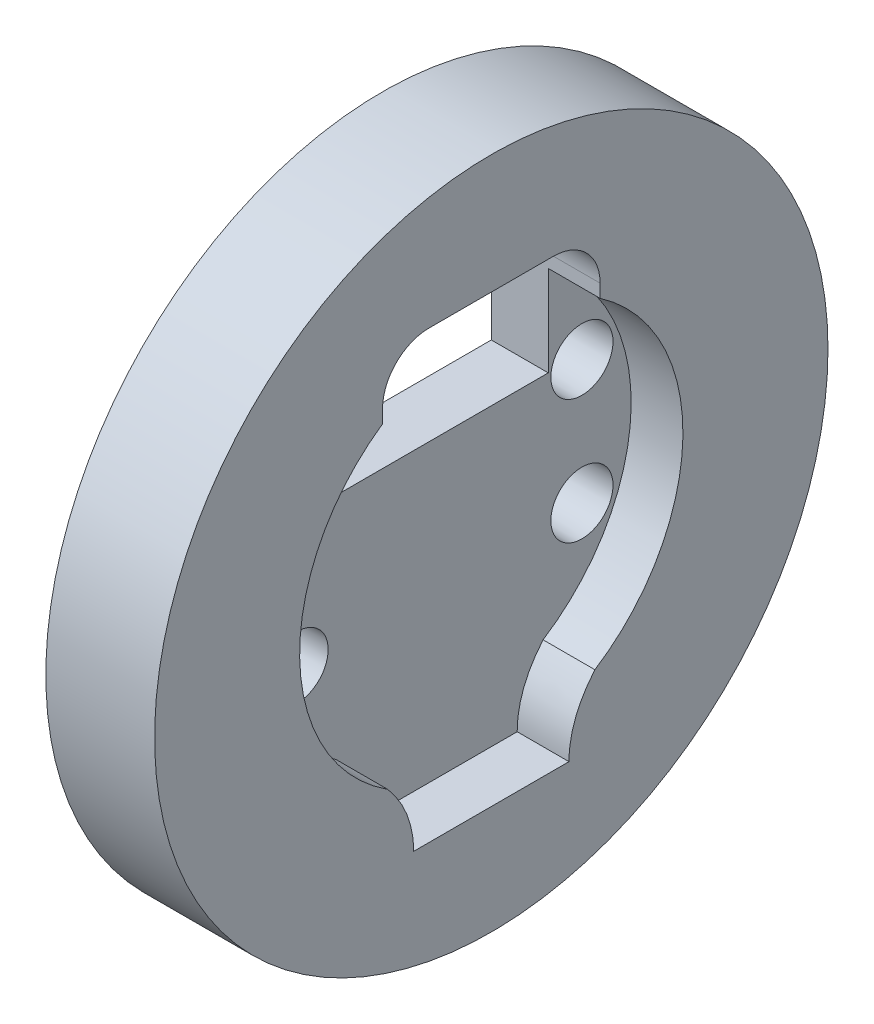
from build123d import *

# Parameters (mm, degrees)
SKETCH2_R                    = 32.5
BOSS_EXTRUDE1_DEPTH          = 10.5
CUT_EXTRUDE1_DEPTH           = 5
CUT_EXTRUDE2_DEPTH           = 10
CUT_EXTRUDE2_DEPTH_BACK      = 47.289847839
SKETCH4_3_R                  = 3
CUT_EXTRUDE4_DEPTH           = 5.5
CUT_EXTRUDE4_DRAFT           = -1
CUT_EXTRUDE4_PROFILE_2_DEPTH = 5.5
CUT_EXTRUDE4_PROFILE_2_DRAFT = -1
CUT_EXTRUDE4_PROFILE_3_DEPTH = 5.5
CUT_EXTRUDE4_PROFILE_3_DRAFT = -1
CUT_EXTRUDE4_PROFILE_4_DEPTH = 5.5
CUT_EXTRUDE4_PROFILE_4_DRAFT = -1
EXTRUDE_THIN1_DEPTH          = 4
EXTRUDE_THIN1_DEPTH_BACK     = 5.5
BOSS_EXTRUDE8_DEPTH          = 4
BOSS_EXTRUDE8_DEPTH_BACK     = 5.5
CUT_EXTRUDE5_DEPTH           = 3.5


with BuildPart() as part:
    # Sketch2 → Boss-Extrude1 (new body)
    with BuildSketch(Plane(origin=(0, 0, 0), x_dir=(0, 0, -1), z_dir=(1, 0, 0))):
        Circle(SKETCH2_R)
    extrude(amount=-BOSS_EXTRUDE1_DEPTH)

    # Sketch3 → Cut-Extrude1 (cut)
    with BuildSketch(Plane(origin=(0, 0, 0), x_dir=(0, 0, -1), z_dir=(1, 0, 0))):
        with BuildLine():
            add(Edge.make_bspline(
                [(-10, -15.564382416), (-7.5, -18.5), (-7.5, -22)],
                knots=[0, 0, 0, 1, 1, 1], degree=2))
            Line((-7.5, -22), (7.5, -22))
            add(Edge.make_bspline(
                [(10, -15.564382416), (7.5, -18.5), (7.5, -22)],
                knots=[0, 0, 0, 1, 1, 1], degree=2))
            ThreePointArc((10, -15.564382416), (0, 18.5), (-10, -15.564382416))
        make_face()
    extrude(amount=-CUT_EXTRUDE1_DEPTH, mode=Mode.SUBTRACT)

    # Sketch4 → Cut-Extrude2 (cut, two sides: drawn at the far end of the back side and taken through both)
    with BuildSketch(Plane(origin=(-5, 0, 0), x_dir=(0, 0, -1), z_dir=(1, 0, 0)).offset(-CUT_EXTRUDE2_DEPTH_BACK)):
        with BuildLine():
            ThreePointArc((-6, 21), (-9.181980515, 19.681980515), (-10.5, 16.5))
            Line((-10.5, 16.5), (-10.5, 6.5))
            Line((-10.5, 6.5), (10.5, 6.5))
            Line((10.5, 6.5), (10.5, 16.5))
            ThreePointArc((10.5, 16.5), (9.181980515, 19.681980515), (6, 21))
            Line((6, 21), (-6, 21))
        make_face()
    extrude(amount=CUT_EXTRUDE2_DEPTH + CUT_EXTRUDE2_DEPTH_BACK, mode=Mode.SUBTRACT)


with BuildPart() as cut_extrude4_tool:
    # Sketch4<3> → Cut-Extrude4 (with draft: the straight prism first)
    with BuildSketch(Plane(origin=(-5, 0, 0), x_dir=(0, 0, -1), z_dir=(1, 0, 0))):
        with Locations((13.747727085, 6)):
            Circle(SKETCH4_3_R)
    extrude(amount=-CUT_EXTRUDE4_DEPTH)
    # Cut-Extrude4: the draft: its side faces are tilted about the plane it starts from
    cut_extrude4_sides = [cut_extrude4_tool.faces().sort_by_distance(p)[0] for p in [
        (-7.75, 6, -10.747727085),
    ]]
    draft(cut_extrude4_sides, Plane(origin=(-5, 0, 0), x_dir=(0, 0, -1), z_dir=(1, 0, 0)), CUT_EXTRUDE4_DRAFT)


with BuildPart() as part_1:
    add(part.part)

    # Cut-Extrude4: cut by cut_extrude4_tool
    add(cut_extrude4_tool.part, mode=Mode.SUBTRACT)


with BuildPart() as cut_extrude4_profile_2_tool:
    # Sketch4<3> → Cut-Extrude4 profile 2 (with draft: the straight prism first)
    with BuildSketch(Plane(origin=(-5, 0, 0), x_dir=(0, 0, -1), z_dir=(1, 0, 0))):
        with Locations((13.747727085, -6)):
            Circle(SKETCH4_3_R)
    extrude(amount=-CUT_EXTRUDE4_PROFILE_2_DEPTH)
    # Cut-Extrude4 profile 2: the draft: its side faces are tilted about the plane it starts from
    cut_extrude4_profile_2_sides = [cut_extrude4_profile_2_tool.faces().sort_by_distance(p)[0] for p in [
        (-7.75, -6, -10.747727085),
    ]]
    draft(cut_extrude4_profile_2_sides, Plane(origin=(-5, 0, 0), x_dir=(0, 0, -1), z_dir=(1, 0, 0)), CUT_EXTRUDE4_PROFILE_2_DRAFT)


with BuildPart() as part_2:
    add(part_1.part)

    # Cut-Extrude4 profile 2: cut by cut_extrude4_profile_2_tool
    add(cut_extrude4_profile_2_tool.part, mode=Mode.SUBTRACT)


with BuildPart() as cut_extrude4_profile_3_tool:
    # Sketch4<3> → Cut-Extrude4 profile 3 (with draft: the straight prism first)
    with BuildSketch(Plane(origin=(-5, 0, 0), x_dir=(0, 0, -1), z_dir=(1, 0, 0))):
        with Locations((-13.747727085, 6)):
            Circle(SKETCH4_3_R)
    extrude(amount=-CUT_EXTRUDE4_PROFILE_3_DEPTH)
    # Cut-Extrude4 profile 3: the draft: its side faces are tilted about the plane it starts from
    cut_extrude4_profile_3_sides = [cut_extrude4_profile_3_tool.faces().sort_by_distance(p)[0] for p in [
        (-7.75, 6, 16.747727085),
    ]]
    draft(cut_extrude4_profile_3_sides, Plane(origin=(-5, 0, 0), x_dir=(0, 0, -1), z_dir=(1, 0, 0)), CUT_EXTRUDE4_PROFILE_3_DRAFT)


with BuildPart() as part_3:
    add(part_2.part)

    # Cut-Extrude4 profile 3: cut by cut_extrude4_profile_3_tool
    add(cut_extrude4_profile_3_tool.part, mode=Mode.SUBTRACT)


with BuildPart() as cut_extrude4_profile_4_tool:
    # Sketch4<3> → Cut-Extrude4 profile 4 (with draft: the straight prism first)
    with BuildSketch(Plane(origin=(-5, 0, 0), x_dir=(0, 0, -1), z_dir=(1, 0, 0))):
        with Locations((-13.747727085, -6)):
            Circle(SKETCH4_3_R)
    extrude(amount=-CUT_EXTRUDE4_PROFILE_4_DEPTH)
    # Cut-Extrude4 profile 4: the draft: its side faces are tilted about the plane it starts from
    cut_extrude4_profile_4_sides = [cut_extrude4_profile_4_tool.faces().sort_by_distance(p)[0] for p in [
        (-7.75, -6, 16.747727085),
    ]]
    draft(cut_extrude4_profile_4_sides, Plane(origin=(-5, 0, 0), x_dir=(0, 0, -1), z_dir=(1, 0, 0)), CUT_EXTRUDE4_PROFILE_4_DRAFT)


with BuildPart() as part_4:
    add(part_3.part)

    # Cut-Extrude4 profile 4: cut by cut_extrude4_profile_4_tool
    add(cut_extrude4_profile_4_tool.part, mode=Mode.SUBTRACT)

    # Sketch10 → Cut-Extrude5 (cut)
    with BuildSketch(Plane.ZY.offset(10.5)):
        with BuildLine():
            Line((1.5, -1), (1.5, 0))
            ThreePointArc((1.5, 0), (0, 1.5), (-1.5, 0))
            Line((-1.5, 0), (-1.5, -1))
            Line((-1.5, -1), (1.5, -1))
        make_face()
    extrude(amount=-CUT_EXTRUDE5_DEPTH, mode=Mode.SUBTRACT)


with BuildPart() as body_2:
    # Sketch5 → Extrude-Thin1 (new, two sides: drawn at the far end of the back side and taken through both)
    with BuildSketch(Plane.ZY.offset(10.5).offset(-EXTRUDE_THIN1_DEPTH_BACK)):
        with BuildLine():
            Line((-3.5, 0), (-3.5, -3))
            Line((-3.5, -3), (3.5, -3))
            Line((3.5, -3), (3.5, 0))
            ThreePointArc((3.5, 0), (0, 3.5), (-3.5, 0))
        make_face()
        with BuildLine():
            Line((-1.5, 0), (-1.5, -1))
            Line((-1.5, -1), (1.5, -1))
            Line((1.5, -1), (1.5, 0))
            ThreePointArc((1.5, 0), (0, 1.5), (-1.5, 0))
        make_face(mode=Mode.SUBTRACT)
    extrude(amount=EXTRUDE_THIN1_DEPTH + EXTRUDE_THIN1_DEPTH_BACK)


with BuildPart() as body_3:
    # Sketch5<4> → Boss-Extrude8 (new, two sides: drawn at the far end of the back side and taken through both)
    with BuildSketch(Plane.ZY.offset(10.5).offset(-BOSS_EXTRUDE8_DEPTH_BACK)):
        Polygon((-1.5, -1), (-1.5, 0), (-1.5, 1), (-5, 1), (-5, -1.5), (-1, -1.5), (0, -1.5), (0, -1), align=None)
        with BuildLine():
            Line((-1.5, 1), (-1.5, 0))
            ThreePointArc((-1.5, 0), (-1.060660172, 1.060660172), (0, 1.5))
            Line((0, 1.5), (1, 1.5))
            Line((1, 1.5), (1, 5))
            Line((1, 5), (-1.5, 5))
            Line((-1.5, 5), (-1.5, 1))
        make_face()
        with BuildLine():
            Line((1, 1.5), (0, 1.5))
            ThreePointArc((0, 1.5), (1.060660172, 1.060660172), (1.5, 0))
            Line((1.5, 0), (1.5, -1))
            Line((1.5, -1), (5, -1))
            Line((5, -1), (5, 1.5))
            Line((5, 1.5), (1, 1.5))
        make_face()
        Polygon((1.5, -1.5), (0, -1.5), (-1, -1.5), (-1, -5), (1.5, -5), align=None)
    extrude(amount=BOSS_EXTRUDE8_DEPTH + BOSS_EXTRUDE8_DEPTH_BACK)


solid = Compound([part_4.part, body_2.part, body_3.part])
